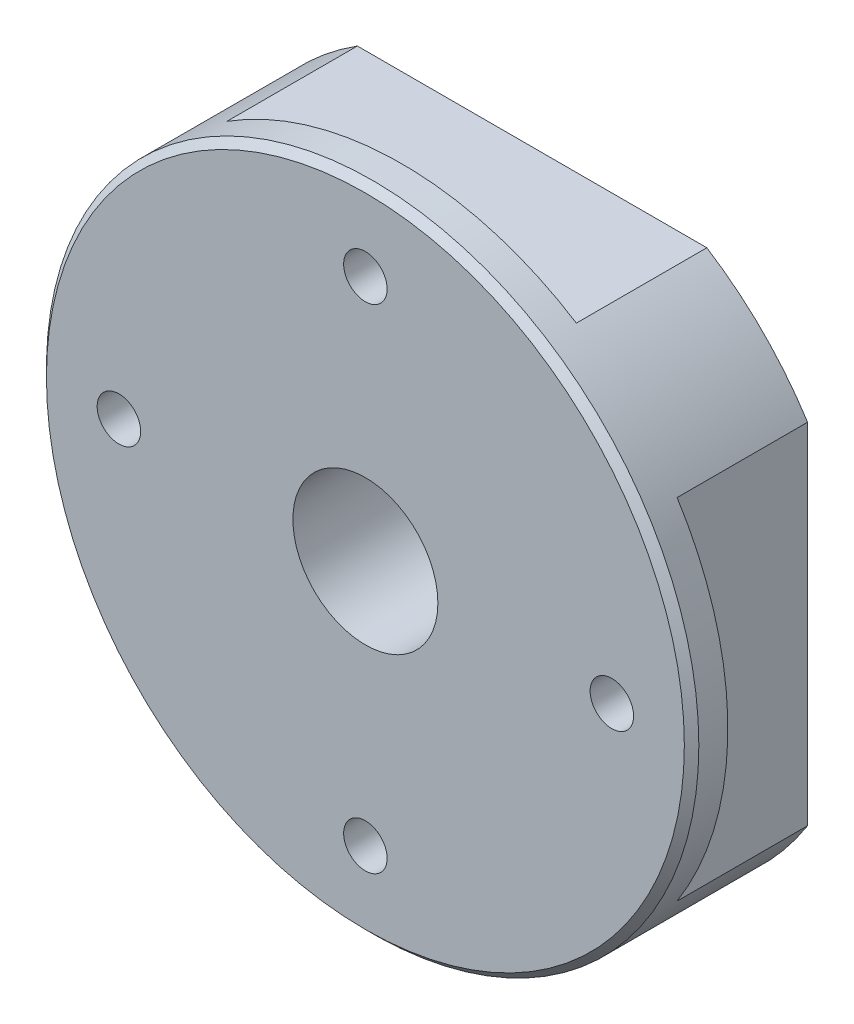
from build123d import *

# Parameters (mm, degrees)
SKETCH_1_R                   = 22.5
SKETCH_1_R_2                 = 5
EXTRUDE_1_DEPTH              = 11.5
SKETCH_2_R                   = 1.5
CUT_EXTRUDE_1_DEPTH          = 5.5
CHAMFER_1_SIZE               = 0.5
SKETCH_3_OUTSIDE_W           = 59.934
SKETCH_3_OUTSIDE_H           = 59.934
SKETCH_3_OUTSIDE_W_2         = 38
SKETCH_3_OUTSIDE_H_2         = 38
CUT_EXTRUDE_2_DEPTH          = 9
HOLE_WIZARD_M4_1_D           = 3.3
HOLE_WIZARD_M4_1_DEPTH       = 3
HOLE_WIZARD_M4_1_CSINK_D     = 4.05
HOLE_WIZARD_M4_1_CSINK_ANGLE = 90
HOLE_WIZARD_M4_1_TIP         = 0.991420021


with BuildPart() as part:
    # 草图1 → 凸台-拉伸1 (new body)
    with BuildSketch(Plane.XY):
        Circle(SKETCH_1_R)
        Circle(SKETCH_1_R_2, mode=Mode.SUBTRACT)
    extrude(amount=EXTRUDE_1_DEPTH)

    # 草图2 → 切除-拉伸1 (cut)
    with BuildSketch(Plane.XY.offset(11.5)):
        with Locations((0, 17)):
            Circle(SKETCH_2_R)
        with Locations((17, 0)):
            Circle(SKETCH_2_R)
        with Locations((0, -17)):
            Circle(SKETCH_2_R)
        with Locations((-17, 0)):
            Circle(SKETCH_2_R)
    extrude(amount=-CUT_EXTRUDE_1_DEPTH, mode=Mode.SUBTRACT)

    # 倒角1
    chamfer_1_edges = [part.edges().sort_by_distance(p)[0] for p in [
        (-22.5, 0, 11.5),
    ]]
    chamfer(chamfer_1_edges, length=CHAMFER_1_SIZE)

    # 草图3 outside → 切除-拉伸2 (cut)
    with BuildSketch(Plane(origin=(0, 0, 0), x_dir=(-1, 0, 0), z_dir=(0, 0, -1))):
        Rectangle(SKETCH_3_OUTSIDE_W, SKETCH_3_OUTSIDE_H)
        Rectangle(SKETCH_3_OUTSIDE_W_2, SKETCH_3_OUTSIDE_H_2, mode=Mode.SUBTRACT)
    extrude(amount=-CUT_EXTRUDE_2_DEPTH, mode=Mode.SUBTRACT)

    # M4 螺纹孔1
    with Locations(Plane(origin=(0, 0, 0), x_dir=(-1, 0, 0), z_dir=(0, 0, -1))):
        with Locations((0, -15.5), (0, 15.5)):
            CounterSinkHole(HOLE_WIZARD_M4_1_D / 2, HOLE_WIZARD_M4_1_CSINK_D / 2, depth=HOLE_WIZARD_M4_1_DEPTH, counter_sink_angle=HOLE_WIZARD_M4_1_CSINK_ANGLE)
            with Locations((0, 0, -(HOLE_WIZARD_M4_1_DEPTH + HOLE_WIZARD_M4_1_TIP / 2))):  # 118° drill point
                Cone(0, HOLE_WIZARD_M4_1_D / 2, HOLE_WIZARD_M4_1_TIP, mode=Mode.SUBTRACT)


solid = part.part
